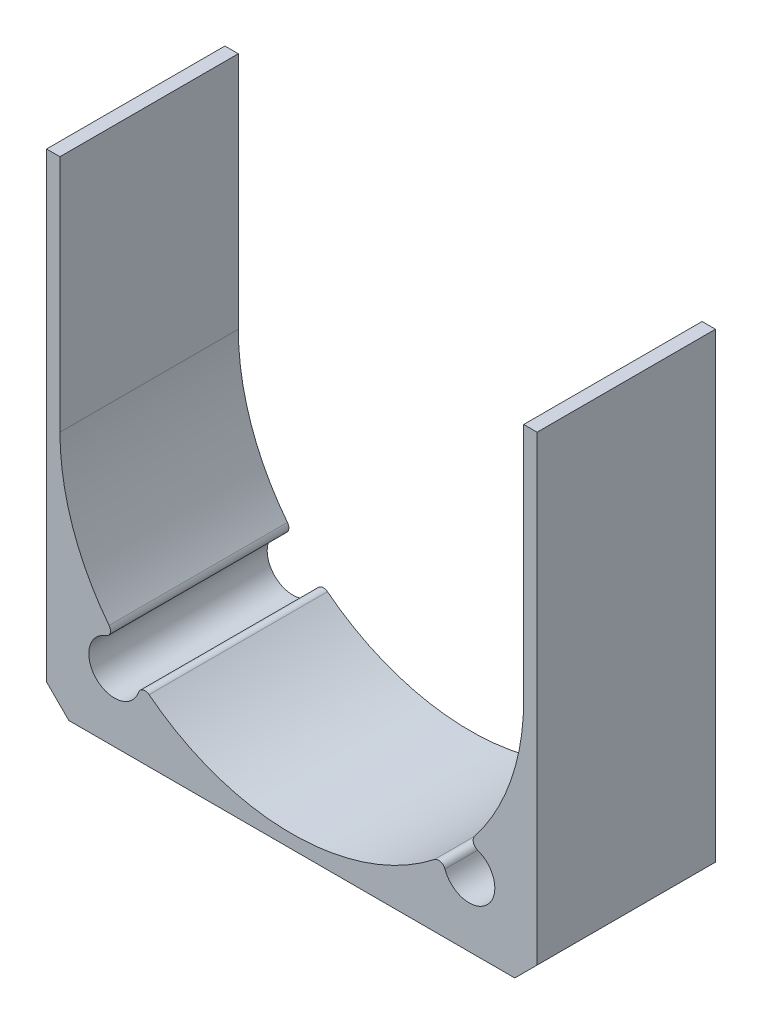
from build123d import *

# Parameters (mm, degrees)
BOSS_EXTRUDE1_DEPTH = 80
SKETCH3_R           = 11.5
CUT_EXTRUDE1_DEPTH  = 175.928556845
FILLET1_R           = 3
CHAMFER1_SIZE       = 10
SKETCH4_W           = 220
SKETCH4_H           = 3
CUT_EXTRUDE2_DEPTH  = 175.928557017


with BuildPart() as part:
    # Sketch1 → Boss-Extrude1 (new body)
    with BuildSketch(Plane.XY):
        with BuildLine():
            Line((-104, 0), (-104, 110))
            Line((-104, 110), (-110, 110))
            Line((-110, 110), (-110, -110))
            Line((-110, -110), (110, -110))
            Line((110, -110), (110, 110))
            Line((110, 110), (104, 110))
            Line((104, 110), (104, 0))
            ThreePointArc((104, 0), (0, -104), (-104, 0))
        make_face()
    extrude(amount=BOSS_EXTRUDE1_DEPTH)

    # Sketch3 → Cut-Extrude1 (cut, through all)
    with BuildSketch(Plane.XY.offset(80)):
        with Locations((-79.549512883, -79.549512883)):
            Circle(SKETCH3_R)
        with Locations((79.549512883, -79.549512883)):
            Circle(SKETCH3_R)
    extrude(amount=-CUT_EXTRUDE1_DEPTH, mode=Mode.SUBTRACT)

    # Fillet1
    fillet1_edges = [part.edges().sort_by_distance(p)[0] for p in [
        (-78.613411263, -68.087675607, 40),
        (-68.087675607, -78.613411263, 40),
        (68.087675607, -78.613411263, 40),
        (78.613411263, -68.087675607, 40),
    ]]
    fillet(fillet1_edges, radius=FILLET1_R)

    # Chamfer1
    chamfer1_edges = [part.edges().sort_by_distance(p)[0] for p in [
        (110, -110, 40),
        (-110, -110, 40),
    ]]
    chamfer(chamfer1_edges, length=CHAMFER1_SIZE)

    # Sketch4 → Cut-Extrude2 (cut, through all)
    with BuildSketch(Plane.XY.offset(80)):
        with Locations((0, 108.5)):
            Rectangle(SKETCH4_W, SKETCH4_H)
    extrude(amount=-CUT_EXTRUDE2_DEPTH, mode=Mode.SUBTRACT)


solid = part.part
